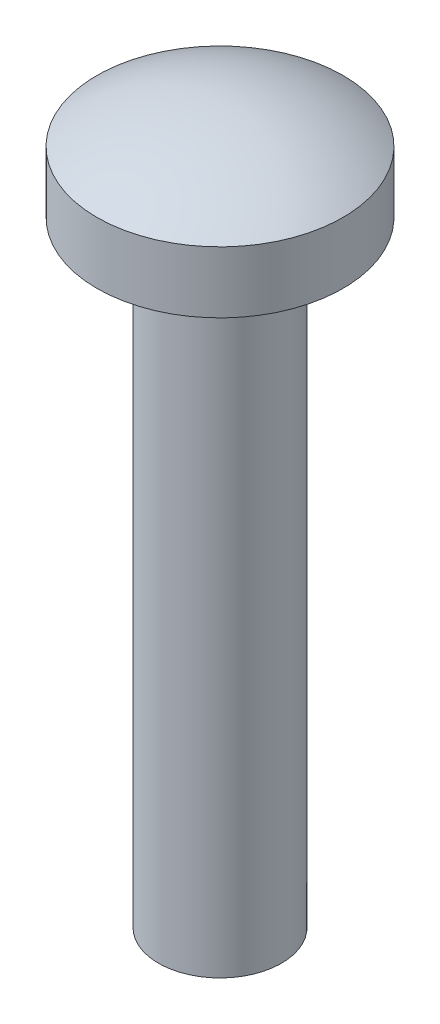
from build123d import *

# Parameters (mm, degrees)
SKETCH3_R           = 1
BOSS_EXTRUDE1_DEPTH = 10


with BuildPart() as part:
    # Sketch2 → Revolve1 (revolve)
    with BuildSketch(Plane(origin=(0, 0, 0), x_dir=(0, 0, -1), z_dir=(1, 0, 0)), mode=Mode.PRIVATE) as revolve1_sk:
        with BuildLine():
            Line((0, 0), (2, 0))
            Line((2, 0), (2, 1))
            ThreePointArc((2, 1), (1.044030651, 1.446768836), (0, 1.6))
            Line((0, 1.6), (0, 0))
        make_face()
    revolve(revolve1_sk.sketch.rotate(Axis((0, 1.6, 0), (0, -1, 0)), 180), axis=Axis((0, 1.6, 0), (0, -1, 0)))

    # Sketch3 → Boss-Extrude1 (add)
    with BuildSketch(Plane.XZ):
        with Locations(Location((0, 0, 0), (0, 0, 270))):
            Circle(SKETCH3_R)
    extrude(amount=BOSS_EXTRUDE1_DEPTH)


solid = part.part
